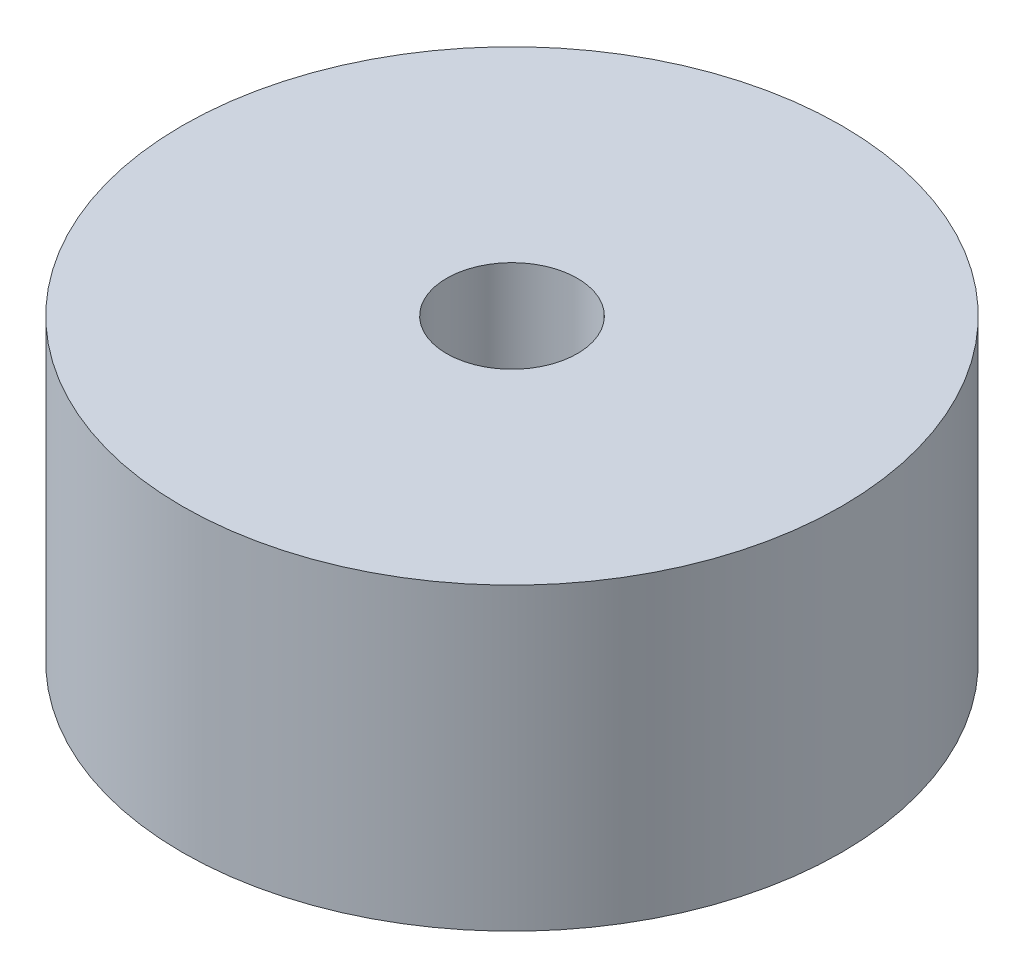
from build123d import *

# Parameters (mm, degrees)
SKETCH1_R           = 5.5
SKETCH1_R_2         = 1.09
BOSS_EXTRUDE1_DEPTH = 5


with BuildPart() as part:
    # Sketch1 → Boss-Extrude1 (new body)
    with BuildSketch(Plane(origin=(0, 0, 0), x_dir=(1, 0, 0), z_dir=(0, 1, 0))):
        with Locations(Location((0, 0, 0), (0, 0, 270))):
            Circle(SKETCH1_R)
        with Locations(Location((0, 0, 0), (0, 0, 270))):
            Circle(SKETCH1_R_2, mode=Mode.SUBTRACT)
    extrude(amount=BOSS_EXTRUDE1_DEPTH)


solid = part.part
